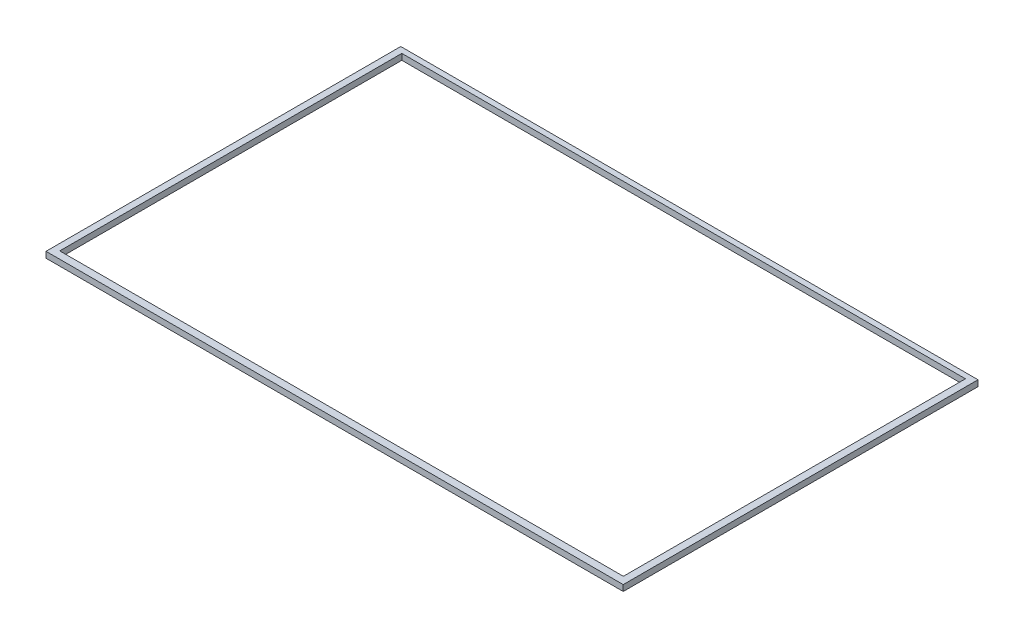
from build123d import *

# Parameters (mm, degrees)
SKETCH1_W           = 152.4
SKETCH1_H           = 93.6625
SKETCH1_W_2         = 148.804455176
SKETCH1_H_2         = 90.317561836
BOSS_EXTRUDE1_DEPTH = 1.5875


with BuildPart() as part:
    # Sketch1 → Boss-Extrude1 (new body)
    with BuildSketch(Plane(origin=(0, 0, 0), x_dir=(1, 0, 0), z_dir=(0, 1, 0))):
        with Locations((76.2, 46.83125)):
            Rectangle(SKETCH1_W, SKETCH1_H)
        with Locations((76.121599339, 47.066451984)):
            Rectangle(SKETCH1_W_2, SKETCH1_H_2, mode=Mode.SUBTRACT)
    extrude(amount=BOSS_EXTRUDE1_DEPTH)


solid = part.part
